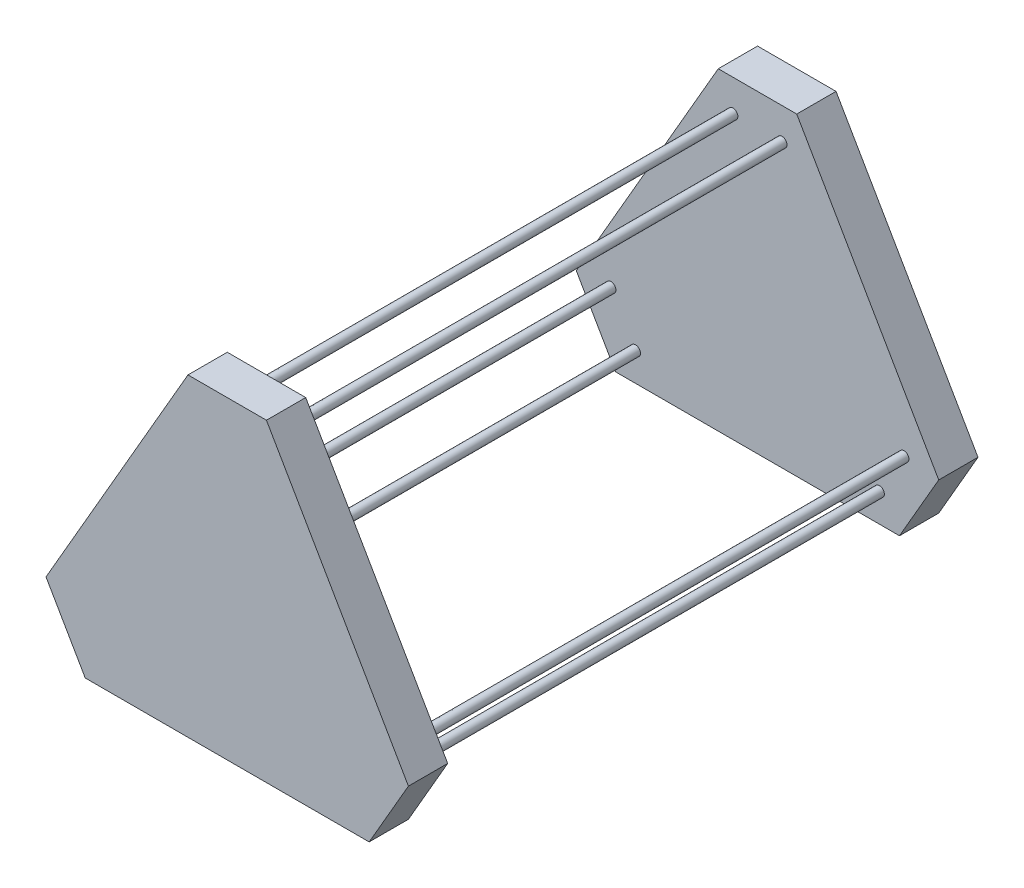
from build123d import *

# Parameters (mm, degrees)
BOSS_EXTRUDE1_DEPTH = 40
SKETCH2_R           = 5
BOSS_EXTRUDE2_DEPTH = 500


with BuildPart() as part:
    # Sketch1 → Boss-Extrude1 (new body)
    with BuildSketch(Plane.XY):
        Polygon((184.521008641, -60.40023797), (39.952363844, 190), (-39.952363844, 190), (-184.521008641, -60.40023797), (-144.568644797, -129.59976203), (144.568644797, -129.59976203), align=None)
    boss_extrude1 = extrude(amount=-BOSS_EXTRUDE1_DEPTH)

    # Sketch2 → Boss-Extrude2 (add)
    with BuildSketch(Plane.XY):
        with Locations((25, 157.841136245)):
            Circle(SKETCH2_R)
        with Locations((-25, 157.841136245)):
            Circle(SKETCH2_R)
        with Locations((124.19443375, -100.571203217)):
            Circle(SKETCH2_R)
        with Locations((149.19443375, -57.269933028)):
            Circle(SKETCH2_R)
        with Locations((-149.19443375, -57.269933028)):
            Circle(SKETCH2_R)
        with Locations((-124.19443375, -100.571203217)):
            Circle(SKETCH2_R)
    extrude(amount=BOSS_EXTRUDE2_DEPTH)

    # Mirror1: Boss-Extrude1 across plane
    add(boss_extrude1.mirror(Plane.XY.offset(250)))


solid = part.part
